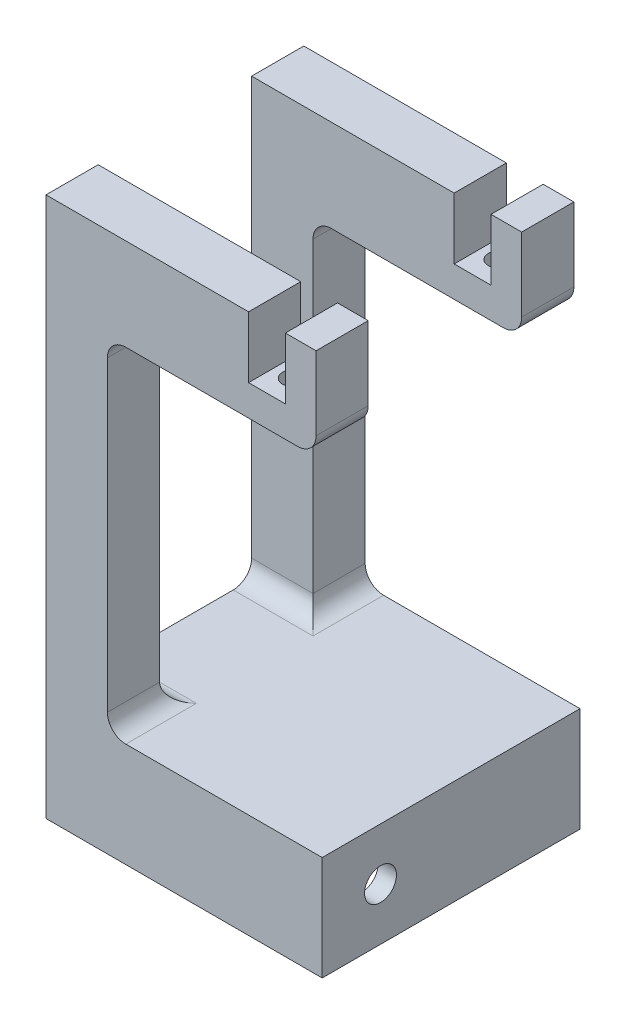
from build123d import *

# Parameters (mm, degrees)
BOSS_EXTRUDE1_DEPTH = 42
SKETCH2_W           = 25
SKETCH2_H           = 71
CUT_EXTRUDE1_DEPTH  = 108.391806019
CUT_EXTRUDE2_REACH  = 101.363
SKETCH4_R           = 1.7
SKETCH7_R           = 2.6
CUT_EXTRUDE3_DEPTH  = 10
FILLET1_R           = 3
FILLET2_R           = 3
SKETCH8_W           = 39
SKETCH8_H           = 36
CUT_EXTRUDE4_DEPTH  = 14


with BuildPart() as part:
    # Sketch1 → Boss-Extrude1 (new body)
    with BuildSketch(Plane.XY):
        Polygon((10, 17), (45, 17), (45, 0), (0, 0), (0, 88), (33, 88), (33, 78), (39, 78), (39, 88), (44, 88), (44, 73), (10, 73), align=None)
    extrude(amount=BOSS_EXTRUDE1_DEPTH)

    # Sketch2 → Cut-Extrude1 (cut, through all)
    with BuildSketch(Plane.ZY):
        with Locations((21, 52.5)):
            Rectangle(SKETCH2_W, SKETCH2_H)
    extrude(amount=-CUT_EXTRUDE1_DEPTH, mode=Mode.SUBTRACT)

    # Sketch4 → Cut-Extrude2 (cut, up to next)
    with BuildSketch(Plane(origin=(0, 78, 0), x_dir=(1, 0, 0), z_dir=(0, 1, 0)), mode=Mode.PRIVATE) as cut_extrude2_sk1:
        with Locations(Location((36, -37.75, 0), (0, 0, 270))):
            Circle(SKETCH4_R)
    cut_extrude2_tool1 = extrude(cut_extrude2_sk1.sketch, amount=-CUT_EXTRUDE2_REACH, mode=Mode.PRIVATE) & part.part
    # Sketch4 → Cut-Extrude2 (cut, up to next)
    with BuildSketch(Plane(origin=(0, 78, 0), x_dir=(1, 0, 0), z_dir=(0, 1, 0)), mode=Mode.PRIVATE) as cut_extrude2_sk2:
        with Locations(Location((36, -4.25, 0), (0, 0, 270))):
            Circle(SKETCH4_R)
    cut_extrude2_tool2 = extrude(cut_extrude2_sk2.sketch, amount=-CUT_EXTRUDE2_REACH, mode=Mode.PRIVATE) & part.part
    add(cut_extrude2_tool1.solids().sort_by_distance((36, 78, 37.75))[0], mode=Mode.SUBTRACT)
    add(cut_extrude2_tool2.solids().sort_by_distance((36, 78, 4.25))[0], mode=Mode.SUBTRACT)

    # Sketch7 → Cut-Extrude3 (cut)
    with BuildSketch(Plane(origin=(45, 0, 0), x_dir=(0, 0, -1), z_dir=(1, 0, 0))):
        with Locations((-32.5, 8.5)):
            Circle(SKETCH7_R)
    extrude(amount=-CUT_EXTRUDE3_DEPTH, mode=Mode.SUBTRACT)

    # Fillet1
    fillet1_edges = [part.edges().sort_by_distance(p)[0] for p in [
        (10, 17, 37.75),
        (10, 17, 4.25),
        (5, 17, 33.5),
        (5, 17, 8.5),
    ]]
    fillet(fillet1_edges, radius=FILLET1_R)

    # Fillet2
    fillet2_edges = [part.edges().sort_by_distance(p)[0] for p in [
        (44, 73, 37.75),
        (10, 73, 37.75),
        (44, 73, 4.25),
        (10, 73, 4.25),
    ]]
    fillet(fillet2_edges, radius=FILLET2_R)

    # Sketch8 → Cut-Extrude4 (cut)
    with BuildSketch(Plane.XZ):
        with Locations((22.5, 21)):
            Rectangle(SKETCH8_W, SKETCH8_H)
    extrude(amount=-CUT_EXTRUDE4_DEPTH, mode=Mode.SUBTRACT)


solid = part.part
